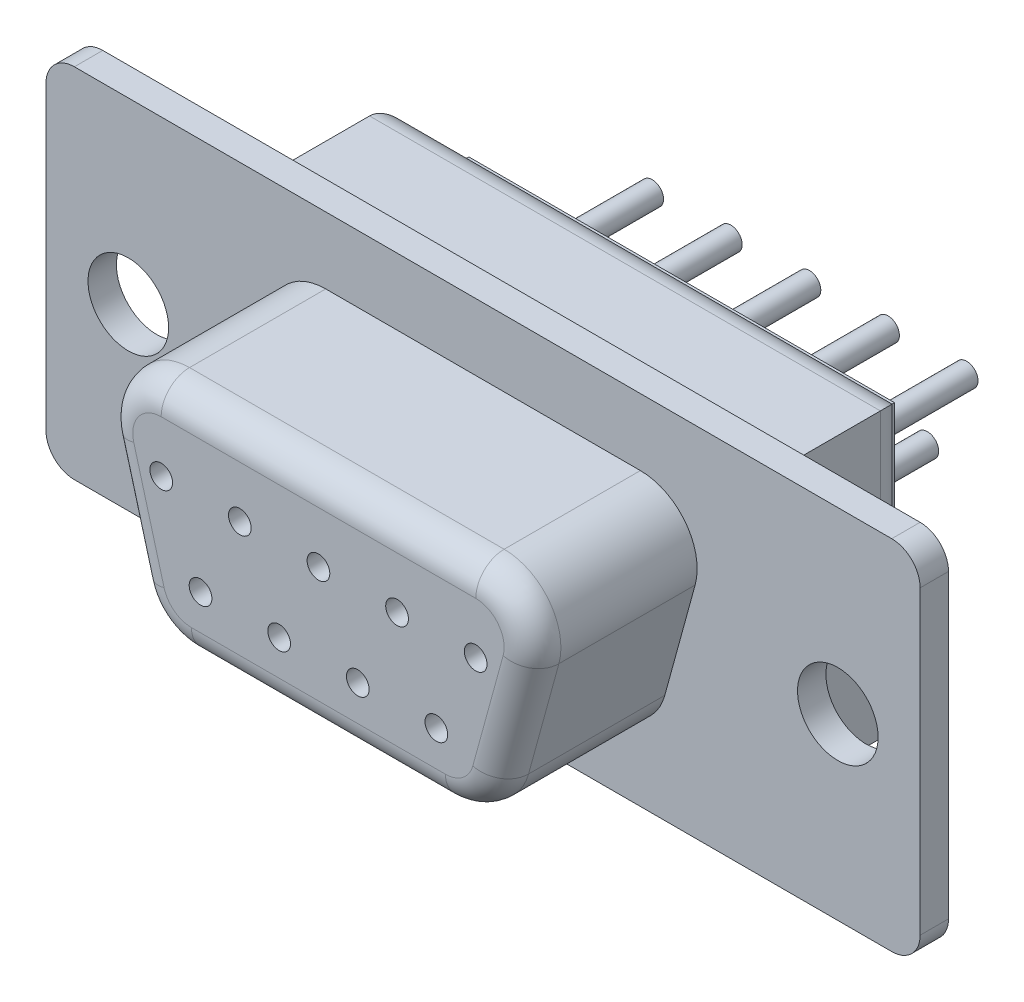
from build123d import *

# Parameters (mm, degrees)
SKETCH_1_W             = 30.8
SKETCH_1_H             = 12.6
EXTRUDE_1_DEPTH        = 1
FILLET_1_R             = 1
EXTRUDE_2_DEPTH        = 5.8
FILLET_2_R             = 2
FILLET_3_R             = 1
SKETCH_3_R             = 1.42
CUT_EXTRUDE_1_DEPTH    = 5.8
SKETCH_4_W             = 18
SKETCH_4_H             = 10
EXTRUDE_3_DEPTH        = 5
FILLET_4_R             = 1
FILLET_6_R             = 1
SKETCH_5_W             = 15
SKETCH_5_H             = 7
EXTRUDE_4_DEPTH        = 1
SKETCH_6_R             = 0.4
CUT_EXTRUDE_2_DEPTH    = 20
PATTERN_LINEAR_1_COUNT = 5
PATTERN_LINEAR_1_PITCH = 2.77
SKETCH_7_R             = 0.4
CUT_EXTRUDE_3_DEPTH    = 20
PATTERN_LINEAR_2_COUNT = 4
PATTERN_LINEAR_2_PITCH = 2.77
SKETCH_8_R             = 0.4
EXTRUDE_5_DEPTH        = 4.5
EXTRUDE_5_2_DEPTH      = 4.5
EXTRUDE_5_3_DEPTH      = 4.5
EXTRUDE_5_4_DEPTH      = 4.5
EXTRUDE_5_5_DEPTH      = 4.5
EXTRUDE_5_6_DEPTH      = 4.5
EXTRUDE_5_7_DEPTH      = 4.5
EXTRUDE_5_8_DEPTH      = 4.5
EXTRUDE_5_9_DEPTH      = 4.5
SKETCH_9_R             = 0.25
CUT_EXTRUDE_4_DEPTH    = 4.5


with BuildPart() as part:
    # Эскиз1 → Бобышка-Вытянуть1 (new body)
    with BuildSketch(Plane.XY):
        Rectangle(SKETCH_1_W, SKETCH_1_H)
    extrude(amount=EXTRUDE_1_DEPTH)

    # Скругление1
    fillet_1_edges = [part.edges().sort_by_distance(p)[0] for p in [
        (15.4, -6.3, 0.5),
        (-15.4, -6.3, 0.5),
        (-15.4, 6.3, 0.5),
        (15.4, 6.3, 0.5),
    ]]
    fillet(fillet_1_edges, radius=FILLET_1_R)

    # Эскиз2 → Бобышка-Вытянуть2 (add)
    with BuildSketch(Plane.XY.offset(1)):
        Polygon((-8.165, 3.95), (8.165, 3.95), (6, -3.95), (-6, -3.95), align=None)
    extrude(amount=EXTRUDE_2_DEPTH)

    # Скругление2
    fillet_2_edges = [part.edges().sort_by_distance(p)[0] for p in [
        (-8.165, 3.95, 3.9),
        (-6, -3.95, 3.9),
        (6, -3.95, 3.9),
        (8.165, 3.95, 3.9),
    ]]
    fillet(fillet_2_edges, radius=FILLET_2_R)

    # Скругление3
    fillet_3_edges = [part.edges().sort_by_distance(p)[0] for p in [
        (0, -3.95, 6.8),
        (-6.937634014, -0.528610295, 6.8),
        (6.937634014, -0.528610295, 6.8),
        (0, 3.95, 6.8),
        (-7.133314998, 3.163008535, 6.8),
        (7.133314998, 3.163008535, 6.8),
        (5.687365603, -3.540160462, 6.8),
        (-5.687365603, -3.540160462, 6.8),
    ]]
    fillet(fillet_3_edges, radius=FILLET_3_R)

    # Эскиз3 → Вырез-Вытянуть1 (cut)
    with BuildSketch(Plane.XY.offset(1)):
        with Locations((-12.5, 0)):
            Circle(SKETCH_3_R)
        with Locations((12.5, 0)):
            Circle(SKETCH_3_R)
    extrude(amount=-CUT_EXTRUDE_1_DEPTH, mode=Mode.SUBTRACT)

    # Эскиз4 → Бобышка-Вытянуть3 (add)
    with BuildSketch(Plane(origin=(0, 0, 0), x_dir=(-1, 0, 0), z_dir=(0, 0, -1))):
        Rectangle(SKETCH_4_W, SKETCH_4_H)
    extrude(amount=EXTRUDE_3_DEPTH)

    # Скругление4
    fillet_4_edges = [part.edges().sort_by_distance(p)[0] for p in [
        (-9, 0, 0),
        (0, 5, 0),
        (9, 0, 0),
        (0, -5, 0),
    ]]
    fillet(fillet_4_edges, radius=FILLET_4_R)

    # Скругление6
    fillet_6_edges = [part.edges().sort_by_distance(p)[0] for p in [
        (-9, 0, -5),
        (0, 5, -5),
        (9, 0, -5),
        (0, -5, -5),
    ]]
    fillet(fillet_6_edges, radius=FILLET_6_R)

    # Эскиз5 → Бобышка-Вытянуть4 (add)
    with BuildSketch(Plane(origin=(0, 0, -5), x_dir=(-1, 0, 0), z_dir=(0, 0, -1))):
        Rectangle(SKETCH_5_W, SKETCH_5_H)
    extrude(amount=EXTRUDE_4_DEPTH)

    # Эскиз6 → Вырез-Вытянуть2 (cut)
    with BuildSketch(Plane.XY.offset(6.8)):
        with Locations((-5.54, 1.135732601)):
            Circle(SKETCH_6_R)
    cut_extrude_2 = extrude(amount=-CUT_EXTRUDE_2_DEPTH, mode=Mode.SUBTRACT)

    # Линейный массив1: Вырез-Вытянуть2 ×5
    with Locations(*[(i * PATTERN_LINEAR_1_PITCH, 0, 0) for i in range(1, PATTERN_LINEAR_1_COUNT)]):
        add(cut_extrude_2, mode=Mode.SUBTRACT)

    # Эскиз7 → Вырез-Вытянуть3 (cut)
    with BuildSketch(Plane.XY.offset(6.8)):
        with Locations((-4.155, -1.704267399)):
            Circle(SKETCH_7_R)
    cut_extrude_3 = extrude(amount=-CUT_EXTRUDE_3_DEPTH, mode=Mode.SUBTRACT)

    # Линейный массив2: Вырез-Вытянуть3 ×4
    with Locations(*[(i * PATTERN_LINEAR_2_PITCH, 0, 0) for i in range(1, PATTERN_LINEAR_2_COUNT)]):
        add(cut_extrude_3, mode=Mode.SUBTRACT)


with BuildPart() as body_2:
    # Эскиз8 → Бобышка-Вытянуть5 (new body)
    with BuildSketch(Plane(origin=(0, 0, -6), x_dir=(-1, 0, 0), z_dir=(0, 0, -1))):
        with Locations((-5.54, 1.135732601)):
            Circle(SKETCH_8_R)
    extrude(amount=EXTRUDE_5_DEPTH)


with BuildPart() as body_3:
    # Эскиз8 → Extrude 5 2 (new body)
    with BuildSketch(Plane(origin=(0, 0, -6), x_dir=(-1, 0, 0), z_dir=(0, 0, -1))):
        with Locations((-2.77, 1.135732601)):
            Circle(SKETCH_8_R)
    extrude(amount=EXTRUDE_5_2_DEPTH)


with BuildPart() as body_4:
    # Эскиз8 → Extrude 5 3 (new body)
    with BuildSketch(Plane(origin=(0, 0, -6), x_dir=(-1, 0, 0), z_dir=(0, 0, -1))):
        with Locations((0, 1.135732601)):
            Circle(SKETCH_8_R)
    extrude(amount=EXTRUDE_5_3_DEPTH)


with BuildPart() as body_5:
    # Эскиз8 → Extrude 5 4 (new body)
    with BuildSketch(Plane(origin=(0, 0, -6), x_dir=(-1, 0, 0), z_dir=(0, 0, -1))):
        with Locations((2.77, 1.135732601)):
            Circle(SKETCH_8_R)
    extrude(amount=EXTRUDE_5_4_DEPTH)


with BuildPart() as body_6:
    # Эскиз8 → Extrude 5 5 (new body)
    with BuildSketch(Plane(origin=(0, 0, -6), x_dir=(-1, 0, 0), z_dir=(0, 0, -1))):
        with Locations((5.54, 1.135732601)):
            Circle(SKETCH_8_R)
    extrude(amount=EXTRUDE_5_5_DEPTH)


with BuildPart() as body_7:
    # Эскиз8 → Extrude 5 6 (new body)
    with BuildSketch(Plane(origin=(0, 0, -6), x_dir=(-1, 0, 0), z_dir=(0, 0, -1))):
        with Locations((4.155, -1.704267399)):
            Circle(SKETCH_8_R)
    extrude(amount=EXTRUDE_5_6_DEPTH)


with BuildPart() as body_8:
    # Эскиз8 → Extrude 5 7 (new body)
    with BuildSketch(Plane(origin=(0, 0, -6), x_dir=(-1, 0, 0), z_dir=(0, 0, -1))):
        with Locations((1.385, -1.704267399)):
            Circle(SKETCH_8_R)
    extrude(amount=EXTRUDE_5_7_DEPTH)


with BuildPart() as body_9:
    # Эскиз8 → Extrude 5 8 (new body)
    with BuildSketch(Plane(origin=(0, 0, -6), x_dir=(-1, 0, 0), z_dir=(0, 0, -1))):
        with Locations((-1.385, -1.704267399)):
            Circle(SKETCH_8_R)
    extrude(amount=EXTRUDE_5_8_DEPTH)


with BuildPart() as body_10:
    # Эскиз8 → Extrude 5 9 (new body)
    with BuildSketch(Plane(origin=(0, 0, -6), x_dir=(-1, 0, 0), z_dir=(0, 0, -1))):
        with Locations((-4.155, -1.704267399)):
            Circle(SKETCH_8_R)
    extrude(amount=EXTRUDE_5_9_DEPTH)


with BuildPart() as cut_extrude_4_tool:
    # Эскиз9 → Вырез-Вытянуть4 (new body)
    with BuildSketch(Plane(origin=(0, 0, -6), x_dir=(-1, 0, 0), z_dir=(0, 0, -1))):
        with Locations((-5.54, 1.135732601)):
            Circle(SKETCH_9_R)
        with Locations((-2.77, 1.135732601)):
            Circle(SKETCH_9_R)
        with Locations((0, 1.135732601)):
            Circle(SKETCH_9_R)
        with Locations((2.77, 1.135732601)):
            Circle(SKETCH_9_R)
        with Locations((-4.155, -1.704267399)):
            Circle(SKETCH_9_R)
        with Locations((-1.385, -1.704267399)):
            Circle(SKETCH_9_R)
        with Locations((1.385, -1.704267399)):
            Circle(SKETCH_9_R)
        with Locations((4.155, -1.704267399)):
            Circle(SKETCH_9_R)
        with Locations((5.54, 1.135732601)):
            Circle(SKETCH_9_R)
    extrude(amount=CUT_EXTRUDE_4_DEPTH)


with BuildPart() as body_2_1:
    add(body_2.part)

    # Вырез-Вытянуть4: cut by cut_extrude_4_tool
    add(cut_extrude_4_tool.part, mode=Mode.SUBTRACT)


with BuildPart() as body_3_1:
    add(body_3.part)

    # Вырез-Вытянуть4: cut by cut_extrude_4_tool
    add(cut_extrude_4_tool.part, mode=Mode.SUBTRACT)


with BuildPart() as body_4_1:
    add(body_4.part)

    # Вырез-Вытянуть4: cut by cut_extrude_4_tool
    add(cut_extrude_4_tool.part, mode=Mode.SUBTRACT)


with BuildPart() as body_5_1:
    add(body_5.part)

    # Вырез-Вытянуть4: cut by cut_extrude_4_tool
    add(cut_extrude_4_tool.part, mode=Mode.SUBTRACT)


with BuildPart() as body_6_1:
    add(body_6.part)

    # Вырез-Вытянуть4: cut by cut_extrude_4_tool
    add(cut_extrude_4_tool.part, mode=Mode.SUBTRACT)


with BuildPart() as body_7_1:
    add(body_7.part)

    # Вырез-Вытянуть4: cut by cut_extrude_4_tool
    add(cut_extrude_4_tool.part, mode=Mode.SUBTRACT)


with BuildPart() as body_8_1:
    add(body_8.part)

    # Вырез-Вытянуть4: cut by cut_extrude_4_tool
    add(cut_extrude_4_tool.part, mode=Mode.SUBTRACT)


with BuildPart() as body_9_1:
    add(body_9.part)

    # Вырез-Вытянуть4: cut by cut_extrude_4_tool
    add(cut_extrude_4_tool.part, mode=Mode.SUBTRACT)


with BuildPart() as body_10_1:
    add(body_10.part)

    # Вырез-Вытянуть4: cut by cut_extrude_4_tool
    add(cut_extrude_4_tool.part, mode=Mode.SUBTRACT)


solid = Compound([part.part, body_2_1.part, body_3_1.part, body_4_1.part, body_5_1.part, body_6_1.part, body_7_1.part, body_8_1.part, body_9_1.part, body_10_1.part])
